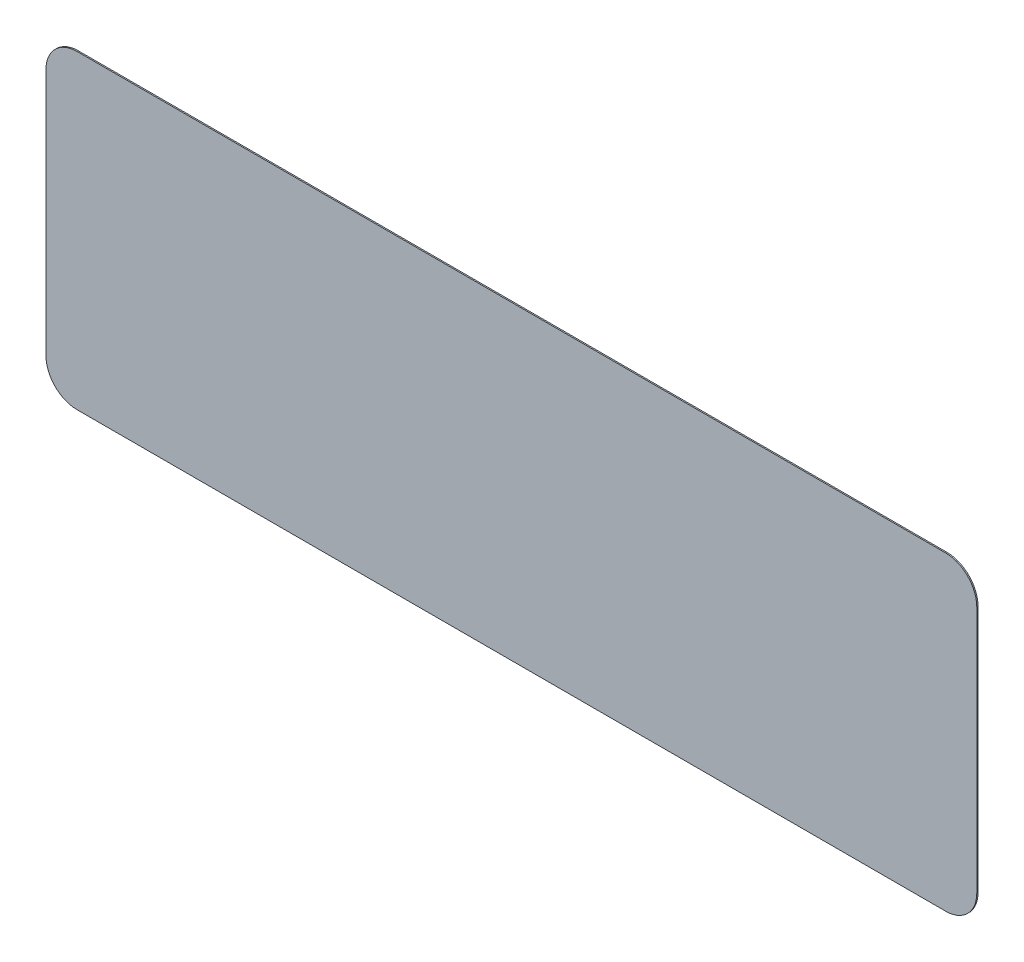
from build123d import *

# Parameters (mm, degrees)
BOSS_EXTRUDE1_DEPTH = 0.1016


with BuildPart() as part:
    # Sketch1 → Boss-Extrude1 (new body)
    with BuildSketch(Plane.XY):
        with BuildLine():
            Line((35.56, 12.7), (-35.56, 12.7))
            ThreePointArc((-35.56, 12.7), (-37.356051224, 11.956051224), (-38.1, 10.16))
            Line((-38.1, 10.16), (-38.1, -10.16))
            ThreePointArc((-38.1, -10.16), (-37.356051224, -11.956051224), (-35.56, -12.7))
            Line((-35.56, -12.7), (35.56, -12.7))
            ThreePointArc((35.56, -12.7), (37.356051224, -11.956051224), (38.1, -10.16))
            Line((38.1, -10.16), (38.1, 10.16))
            ThreePointArc((38.1, 10.16), (37.356051224, 11.956051224), (35.56, 12.7))
        make_face()
    extrude(amount=BOSS_EXTRUDE1_DEPTH)


solid = part.part
